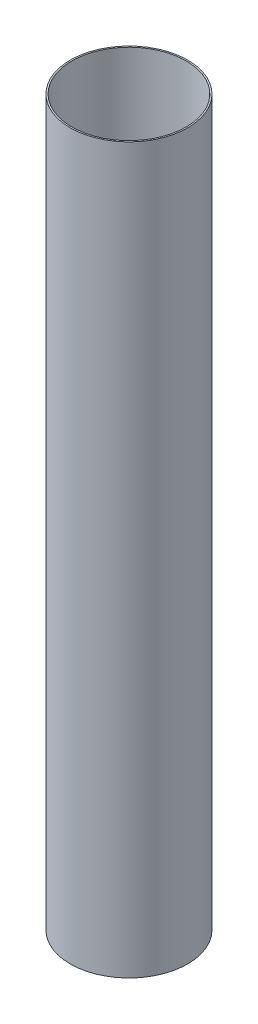
from build123d import *

# Parameters (mm, degrees)
SCHIZZO1_R                = 60
SCHIZZO1_R_2              = 58.5
ESTRUSIONE_SOTTILE1_DEPTH = 370


with BuildPart() as part:
    # Schizzo1 → Estrusione-Sottile1 (new, symmetric)
    with BuildSketch(Plane(origin=(0, 0, 0), x_dir=(1, 0, 0), z_dir=(0, 1, 0))):
        Circle(SCHIZZO1_R)
        Circle(SCHIZZO1_R_2, mode=Mode.SUBTRACT)
    extrude(amount=ESTRUSIONE_SOTTILE1_DEPTH, both=True)


solid = part.part
